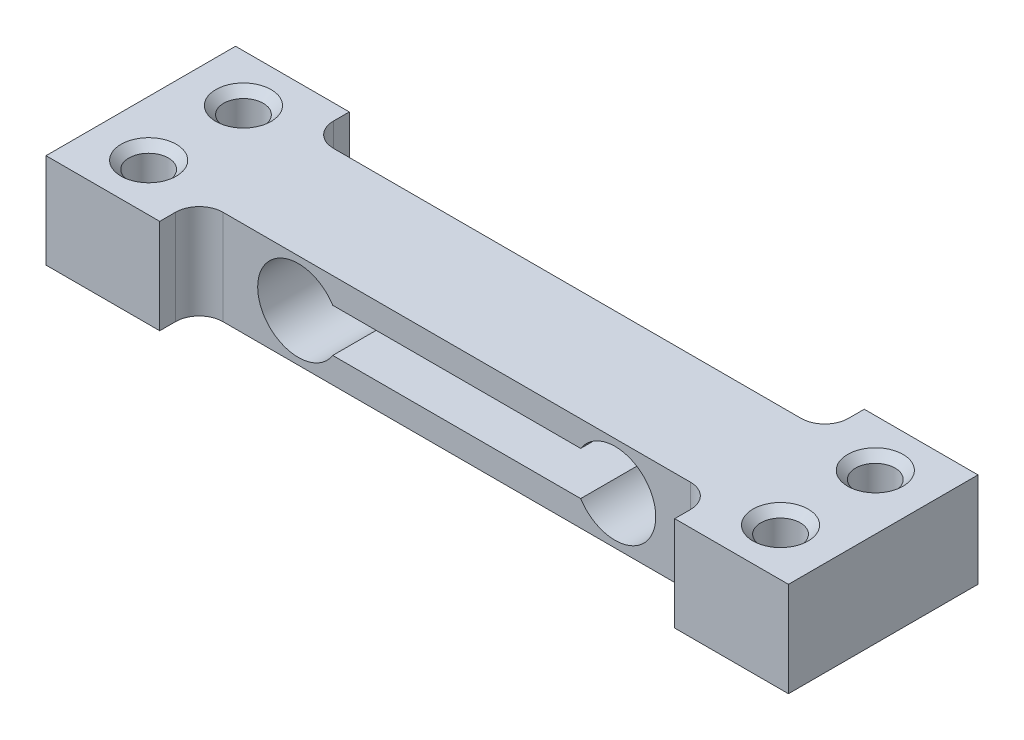
from build123d import *

# Parameters (mm, degrees)
BOSS_EXTRUDE1_DEPTH        = 3
CUT_EXTRUDE1_DEPTH         = 26.524498036
M3_TAPPED_HOLE1_AT_2_COUNT = 2
M3_TAPPED_HOLE1_AT_2_PITCH = 6


with BuildPart() as part:
    # Sketch1 → Boss-Extrude1 (new, symmetric)
    with BuildSketch(Plane(origin=(0, 0, 0), x_dir=(1, 0, 0), z_dir=(0, 1, 0))):
        with BuildLine():
            Line((0, -3.5), (0, 3.5))
            Line((0, 3.5), (14.8, 3.5))
            ThreePointArc((14.8, 3.5), (15.860660172, 3.939339828), (16.3, 5))
            Line((16.3, 5), (16.3, 6))
            Line((16.3, 6), (23.5, 6))
            Line((23.5, 6), (23.5, -6))
            Line((23.5, -6), (16.3, -6))
            Line((16.3, -6), (16.3, -5))
            ThreePointArc((16.3, -5), (15.860660172, -3.939339828), (14.8, -3.5))
            Line((14.8, -3.5), (0, -3.5))
        make_face()
    extrude(amount=BOSS_EXTRUDE1_DEPTH, both=True)

    # Sketch2 → Cut-Extrude1 (cut, through all)
    with BuildSketch(Plane.XY.offset(3.5)):
        with BuildLine():
            ThreePointArc((7.847845894, 1.375), (7.45, 0), (7.847845894, -1.375))
            Line((7.847845894, -1.375), (10.025, -1.375))
            Line((10.025, -1.375), (10.025, 1.375))
            Line((10.025, 1.375), (7.847845894, 1.375))
        make_face()
        with BuildLine():
            Line((10.025, -1.375), (7.847845894, -1.375))
            ThreePointArc((7.847845894, -1.375), (10.740700069, -2.473539652), (12.6, 0))
            ThreePointArc((12.6, 0), (10.740700069, 2.473539652), (7.847845894, 1.375))
            Line((7.847845894, 1.375), (10.025, 1.375))
            Line((10.025, 1.375), (10.025, -1.375))
        make_face()
        with BuildLine():
            Line((0, 1.375), (0, -1.375))
            Line((0, -1.375), (7.847845894, -1.375))
            ThreePointArc((7.847845894, -1.375), (7.45, 0), (7.847845894, 1.375))
            Line((7.847845894, 1.375), (0, 1.375))
        make_face()
    extrude(amount=-CUT_EXTRUDE1_DEPTH, mode=Mode.SUBTRACT)

    # Sketch5 → M3 Tapped Hole1 (revolve, cut)
    with BuildSketch(Plane(origin=(20, 3, -3), x_dir=(0, 0, 1), z_dir=(1, 0, 0))):
        Polygon((0, 0), (0, 6), (1.75, 6), (1.25, 5.5), (1.25, 0.5), (1.75, 0), align=None)
    m3_tapped_hole1 = revolve(axis=Axis((20, 9.35, -3), (0, -1, 0)), mode=Mode.SUBTRACT)

    # M3 Tapped Hole1 at 2: M3 Tapped Hole1 ×2
    with Locations(*[(0, 0, i * M3_TAPPED_HOLE1_AT_2_PITCH) for i in range(1, M3_TAPPED_HOLE1_AT_2_COUNT)]):
        add(m3_tapped_hole1, mode=Mode.SUBTRACT)

    # Mirror1: part across plane


with BuildPart() as part_1:
    add(part.part)
    add(part.part.mirror(Plane(origin=(0, 0, 0), x_dir=(0, 0, 1), z_dir=(1, 0, 0))))


solid = part_1.part
